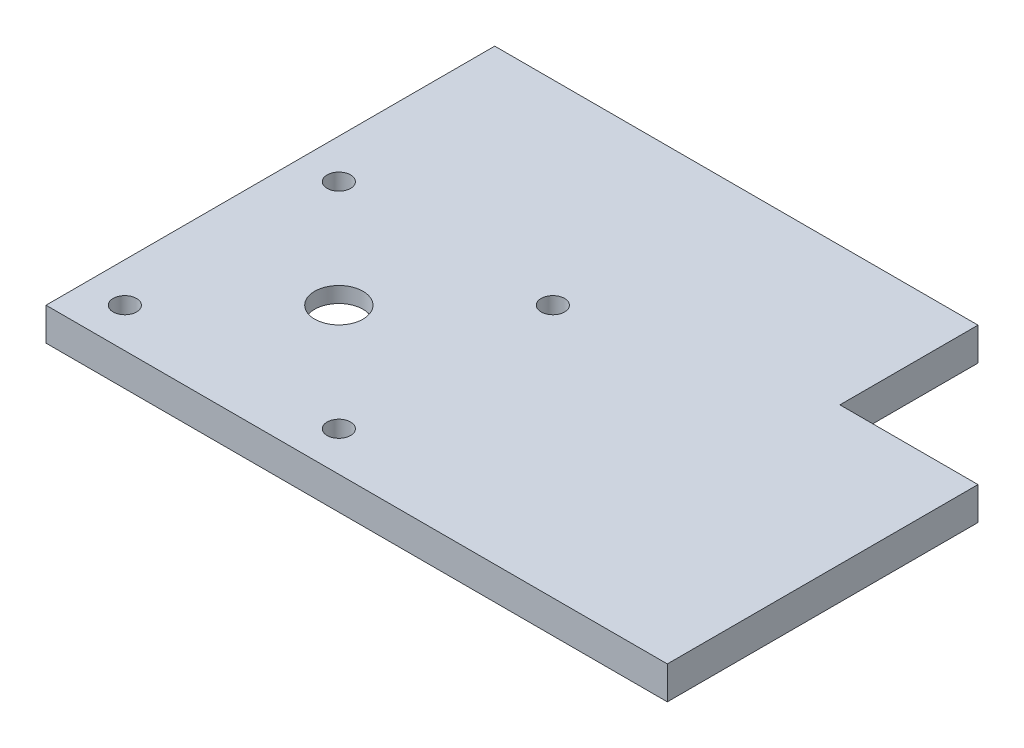
from build123d import *

# Parameters (mm, degrees)
BOSS_EXTRUDE1_DEPTH      = 4.7625
M3_CLEARANCE_HOLE1_D     = 3.4
F_7_0_7_DIAMETER_HOLE1_D = 7
SKETCH12_R               = 11.5
CUT_EXTRUDE1_DEPTH       = 2.5


with BuildPart() as part:
    # Sketch1 → Boss-Extrude1 (new body)
    with BuildSketch(Plane(origin=(0, 0, 0), x_dir=(1, 0, 0), z_dir=(0, 1, 0))):
        Polygon((70, 65), (70, 45), (90, 45), (90, 0), (0, 0), (0, 65), align=None)
    extrude(amount=BOSS_EXTRUDE1_DEPTH)

    # M3 Clearance Hole1 (through all)
    with Locations(Plane(origin=(0, 4.7625, 0), x_dir=(1, 0, 0), z_dir=(0, 1, 0))):
        with Locations((36.709, 5.709), (36.709, 36.709), (5.709, 36.709), (5.709, 5.709)):
            Hole(M3_CLEARANCE_HOLE1_D / 2)

    # Ø7.0 (7) Diameter Hole1 (through all)
    with Locations(Plane(origin=(0, 0, 0), x_dir=(-1, 0, 0), z_dir=(0, -1, 0))):
        with Locations((-21.209, 21.209)):
            Hole(F_7_0_7_DIAMETER_HOLE1_D / 2)

    # Sketch12 → Cut-Extrude1 (cut)
    with BuildSketch(Plane.XZ):
        with Locations(Location((21.209, -21.209, 0), (0, 0, 270))):
            Circle(SKETCH12_R)
    extrude(amount=-CUT_EXTRUDE1_DEPTH, mode=Mode.SUBTRACT)


solid = part.part
